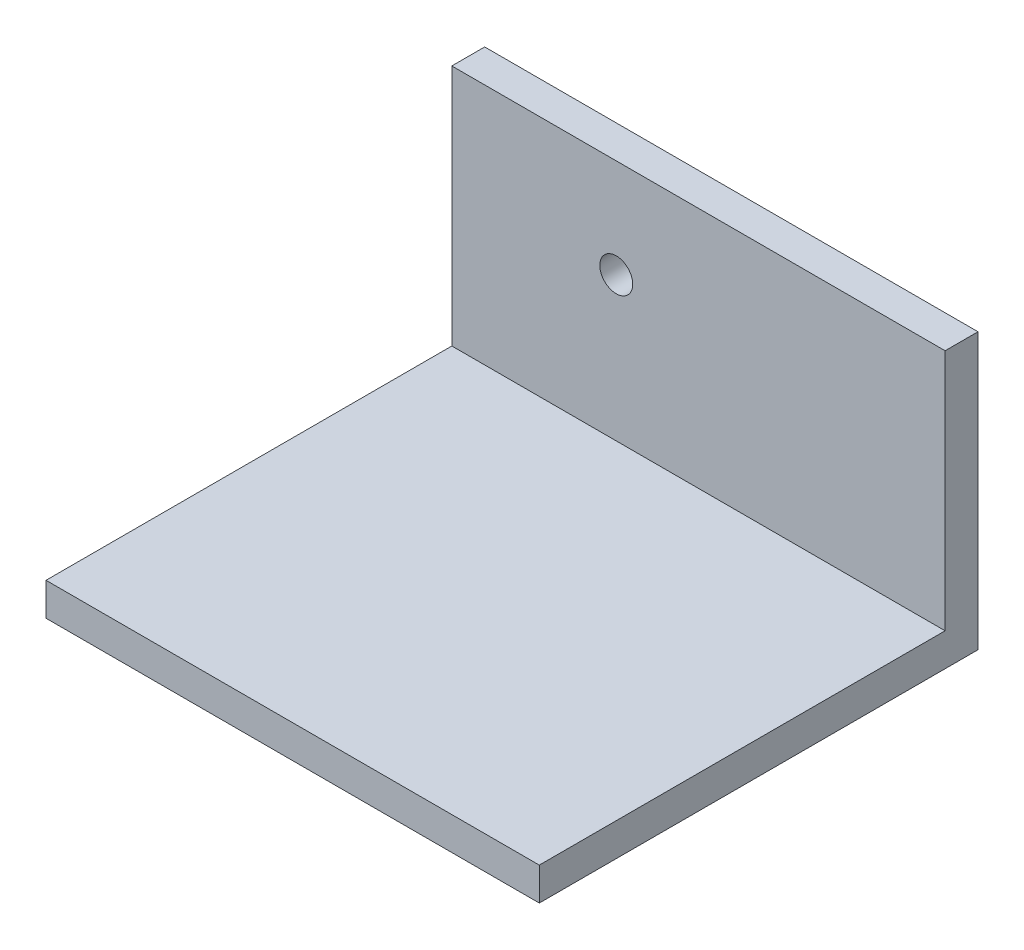
from build123d import *

# Parameters (mm, degrees)
SK_HORN_PLATE_W   = 60
SK_HORN_PLATE_H   = 33.5
SK_HORN_PLATE_R   = 2
HORN_PLATE_DEPTH  = 4
SK_SERVO_PLATE_W  = 60
SK_SERVO_PLATE_H  = 53.36
SERVO_PLATE_DEPTH = 4


with BuildPart() as part:
    # SK_Horn_Plate → Horn_Plate (new body)
    with BuildSketch(Plane.XY.offset(3)):
        with Locations((10, -4.75)):
            Rectangle(SK_HORN_PLATE_W, SK_HORN_PLATE_H)
        Circle(SK_HORN_PLATE_R, mode=Mode.SUBTRACT)
    extrude(amount=HORN_PLATE_DEPTH)

    # SK_Servo_Plate → Servo_Plate (add)
    with BuildSketch(Plane(origin=(0, -21.5, 0), x_dir=(1, 0, 0), z_dir=(0, 1, 0))):
        with Locations((10, -29.68)):
            Rectangle(SK_SERVO_PLATE_W, SK_SERVO_PLATE_H)
    extrude(amount=SERVO_PLATE_DEPTH)


solid = part.part
